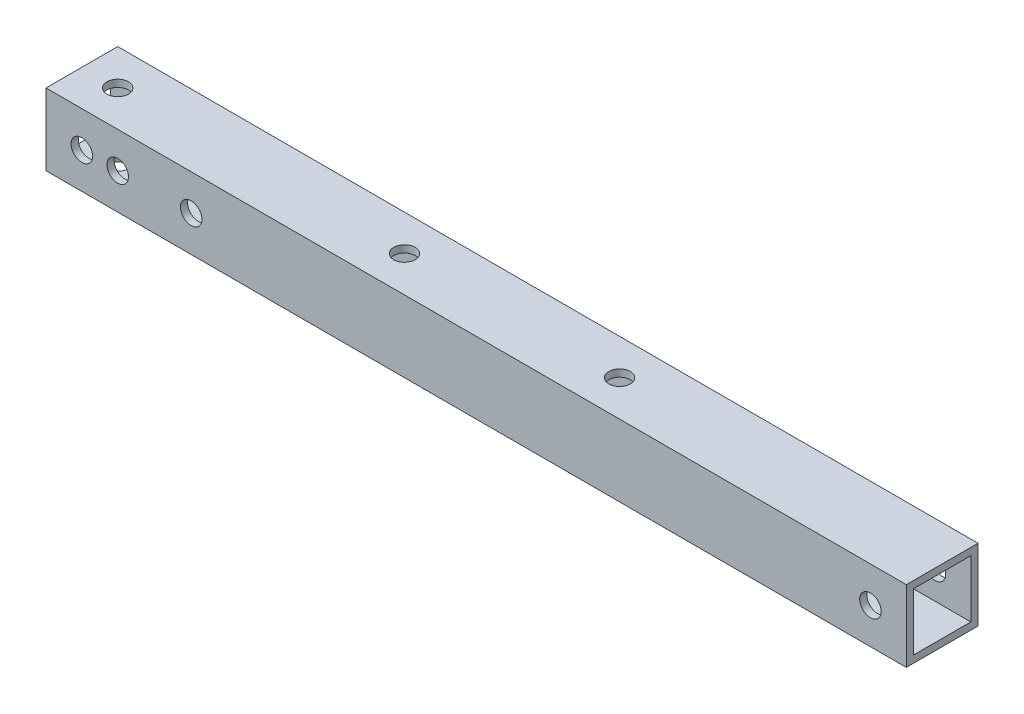
from build123d import *

# Parameters (mm, degrees)
SKETCH_1_W          = 10
SKETCH_1_H          = 10
SKETCH_1_W_2        = 8
SKETCH_1_H_2        = 8
EXTRUDE_1_DEPTH     = 120
SKETCH_3_R          = 1.5
CUT_EXTRUDE_1_DEPTH = 121.519707932
SKETCH_4_R          = 1.5
CUT_EXTRUDE_2_DEPTH = 121.519707932


with BuildPart() as part:
    # ｽｹｯﾁ1 → 押し出し-薄板1 (new body)
    with BuildSketch(Plane(origin=(0, 0, 0), x_dir=(0, 0, -1), z_dir=(1, 0, 0))):
        Rectangle(SKETCH_1_W, SKETCH_1_H)
        Rectangle(SKETCH_1_W_2, SKETCH_1_H_2, mode=Mode.SUBTRACT)
    extrude(amount=EXTRUDE_1_DEPTH)

    # ｽｹｯﾁ3 → ｶｯﾄ - 押し出し1 (cut, through all)
    with BuildSketch(Plane.XY.offset(5)):
        with Locations((115, 0)):
            Circle(SKETCH_3_R)
        with Locations((10, 0)):
            Circle(SKETCH_3_R)
        with Locations((20.25, 0)):
            Circle(SKETCH_3_R)
        with Locations((5, 0)):
            Circle(SKETCH_3_R)
    extrude(amount=-CUT_EXTRUDE_1_DEPTH, mode=Mode.SUBTRACT)

    # ｽｹｯﾁ4 → ｶｯﾄ - 押し出し2 (cut, through all)
    with BuildSketch(Plane(origin=(0, 5, 0), x_dir=(1, 0, 0), z_dir=(0, 1, 0))):
        with Locations(Location((5, 0, 0), (0, 0, 270))):
            Circle(SKETCH_4_R)
        with Locations(Location((45, 0, 0), (0, 0, 270))):
            Circle(SKETCH_4_R)
        with Locations(Location((75, 0, 0), (0, 0, 270))):
            Circle(SKETCH_4_R)
    extrude(amount=-CUT_EXTRUDE_2_DEPTH, mode=Mode.SUBTRACT)


solid = part.part
